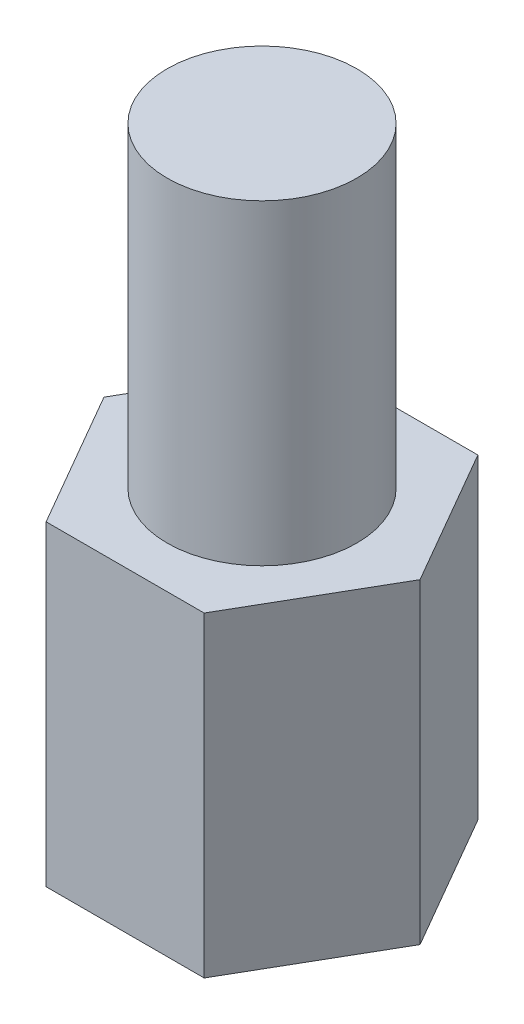
from build123d import *

# Parameters (mm, degrees)
EXTRUDE_1_DEPTH     = 5
SKETCH_2_R          = 1.5
EXTRUDE_2_DEPTH     = 5
SKETCH_3_R          = 1.5
CUT_EXTRUDE_1_DEPTH = 3


with BuildPart() as part:
    # Эскиз1 → Бобышка-Вытянуть1 (new body)
    with BuildSketch(Plane(origin=(0, 0, 0), x_dir=(1, 0, 0), z_dir=(0, 1, 0))):
        Polygon((1.25, -2.165063509), (2.5, 0), (1.25, 2.165063509), (-1.25, 2.165063509), (-2.5, 0), (-1.25, -2.165063509), align=None)
    extrude(amount=EXTRUDE_1_DEPTH)

    # Эскиз2 → Бобышка-Вытянуть2 (add)
    with BuildSketch(Plane(origin=(0, 5, 0), x_dir=(1, 0, 0), z_dir=(0, 1, 0))):
        with Locations(Location((0, 0, 0), (0, 0, 270))):
            Circle(SKETCH_2_R)
    extrude(amount=EXTRUDE_2_DEPTH)

    # Эскиз3 → Вырез-Вытянуть1 (cut)
    with BuildSketch(Plane.XZ):
        with Locations(Location((0, 0, 0), (0, 0, 90))):
            Circle(SKETCH_3_R)
    extrude(amount=-CUT_EXTRUDE_1_DEPTH, mode=Mode.SUBTRACT)


solid = part.part
